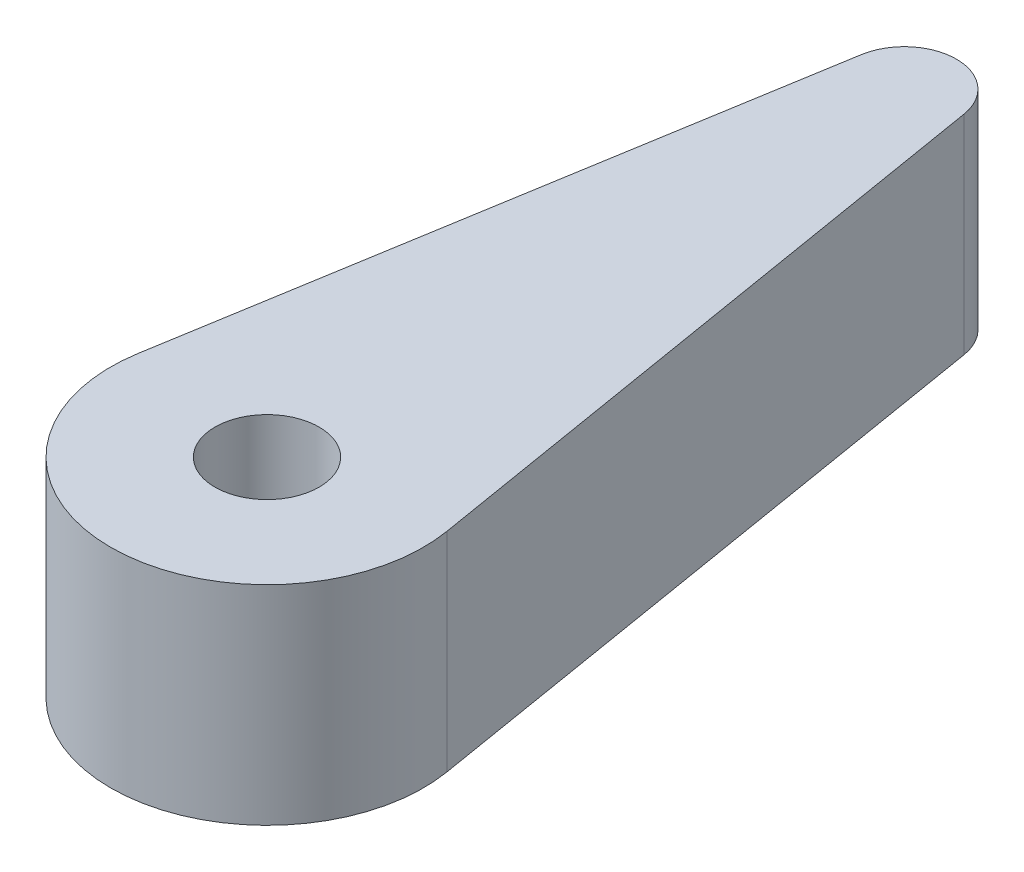
from build123d import *

# Parameters (mm, degrees)
SKETCH1_R           = 2.5
BOSS_EXTRUDE1_DEPTH = 10


with BuildPart() as part:
    # Sketch1 → Boss-Extrude1 (new body)
    with BuildSketch(Plane(origin=(0, 0, 0), x_dir=(1, 0, 0), z_dir=(0, 1, 0))):
        with BuildLine():
            Line((-7.399049906, 1.22640144), (-2.466349969, 30.986063989))
            ThreePointArc((-2.466349969, 30.986063989), (0.004647131, 33.07725919), (2.467852721, 30.976892019))
            Line((2.467852721, 30.976892019), (7.399049203, 1.226405679))
            ThreePointArc((7.399049203, 1.226405679), (2.148e-06, -7.5), (-7.399049906, 1.22640144))
        make_face()
        with Locations(Location((0, 0, 0), (0, 0, 270))):
            Circle(SKETCH1_R, mode=Mode.SUBTRACT)
    extrude(amount=BOSS_EXTRUDE1_DEPTH)


solid = part.part
